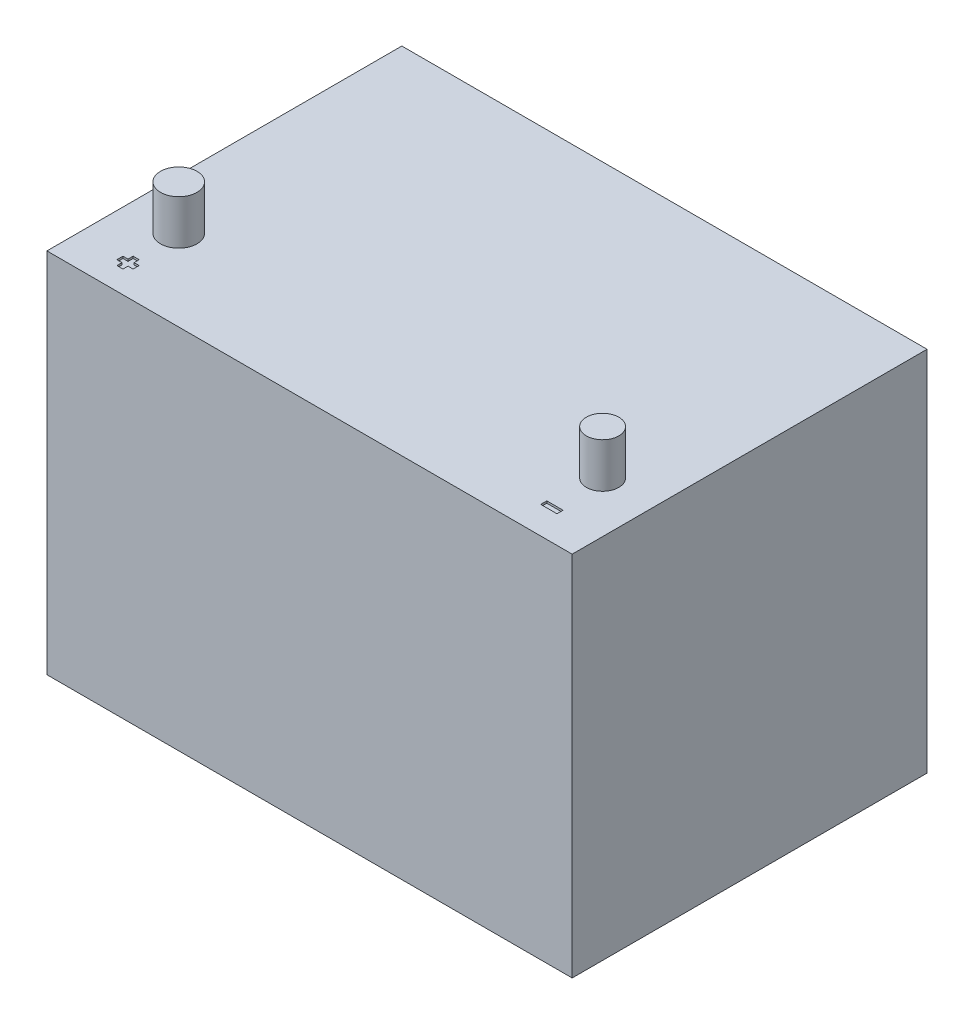
from build123d import *

# Parameters (mm, degrees)
SKETCH1_W           = 259
SKETCH1_H           = 175
BOSS_EXTRUDE1_DEPTH = 181
SKETCH2_R           = 9
SKETCH2_R_2         = 8
BOSS_EXTRUDE2_DEPTH = 22
SKETCH3_W           = 2.5
SKETCH3_H           = 3
SKETCH3_W_2         = 3
SKETCH3_H_2         = 2.5
SKETCH3_W_3         = 8
CUT_EXTRUDE1_DEPTH  = 1


with BuildPart() as part:
    # Sketch1 → Boss-Extrude1 (new body)
    with BuildSketch(Plane(origin=(0, 0, 0), x_dir=(1, 0, 0), z_dir=(0, 1, 0))):
        Rectangle(SKETCH1_W, SKETCH1_H)
    extrude(amount=BOSS_EXTRUDE1_DEPTH)

    # Sketch2 → Boss-Extrude2 (add)
    with BuildSketch(Plane(origin=(0, 181, 0), x_dir=(1, 0, 0), z_dir=(0, 1, 0))):
        with Locations(Location((-104.5, -47.5, 0), (0, 0, 270))):
            Circle(SKETCH2_R)
        with Locations(Location((104.5, -47.5, 0), (0, 0, 270))):
            Circle(SKETCH2_R_2)
    extrude(amount=BOSS_EXTRUDE2_DEPTH)

    # Sketch3 → Cut-Extrude1 (cut)
    with BuildSketch(Plane(origin=(0, 181, 0), x_dir=(1, 0, 0), z_dir=(0, 1, 0))):
        with Locations((-107.25, -72.5)):
            Rectangle(SKETCH3_W, SKETCH3_H)
        with Locations((-104.5, -72.5)):
            Rectangle(SKETCH3_W_2, SKETCH3_H)
        with Locations((-104.5, -69.75)):
            Rectangle(SKETCH3_W_2, SKETCH3_H_2)
        with Locations((-101.75, -72.5)):
            Rectangle(SKETCH3_W, SKETCH3_H)
        with Locations((-104.5, -75.25)):
            Rectangle(SKETCH3_W_2, SKETCH3_H_2)
        with Locations((104.5, -72.5)):
            Rectangle(SKETCH3_W_3, SKETCH3_H)
    extrude(amount=-CUT_EXTRUDE1_DEPTH, mode=Mode.SUBTRACT)


solid = part.part
